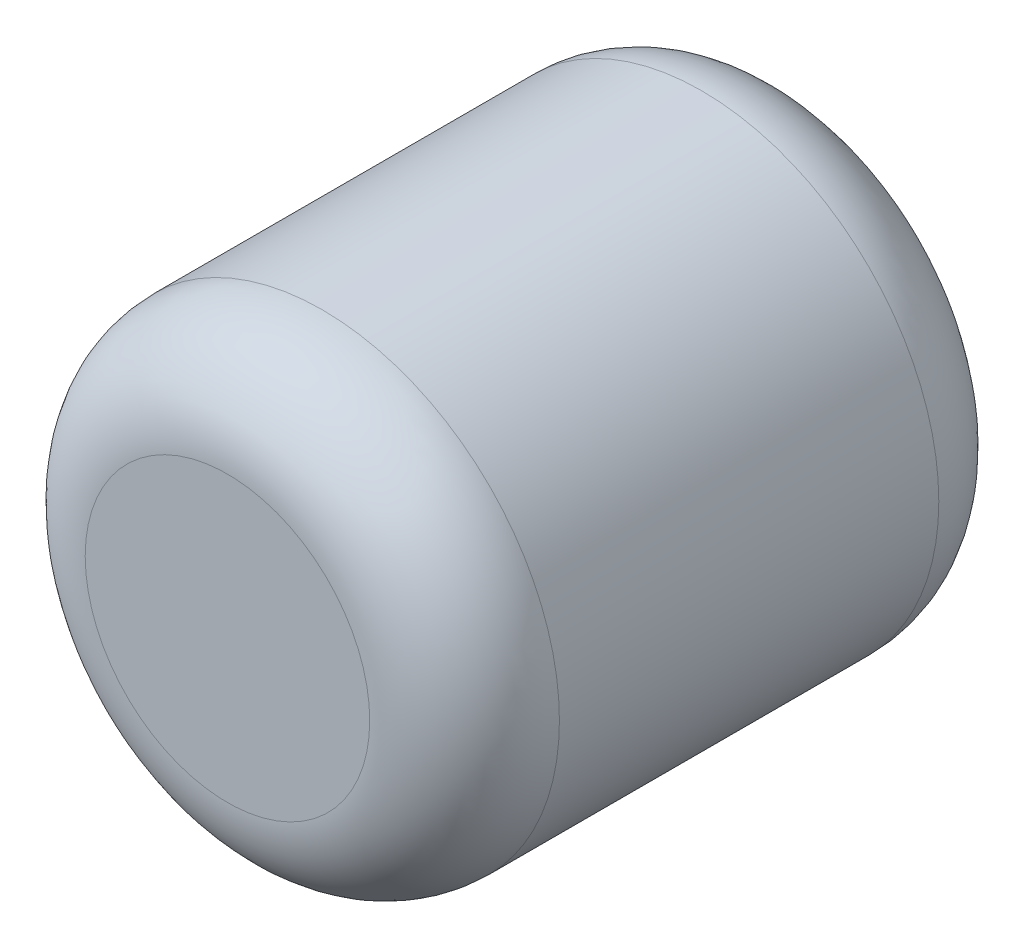
from build123d import *

# Parameters (mm, degrees)
ESQUISSE1_R        = 63.5
BOSS_EXTRU_1_DEPTH = 152.4
CONG_1_R           = 25.4


with BuildPart() as part:
    # Esquisse1 → Boss.-Extru.1 (new body)
    with BuildSketch(Plane.XY):
        with Locations(Location((0, 0, 0), (0, 0, 180))):
            Circle(ESQUISSE1_R)
    extrude(amount=BOSS_EXTRU_1_DEPTH)

    # Congé1
    cong_1_edges = [part.edges().sort_by_distance(p)[0] for p in [
        (63.5, 0, 0),
        (63.5, 0, 152.4),
    ]]
    fillet(cong_1_edges, radius=CONG_1_R)


solid = part.part
